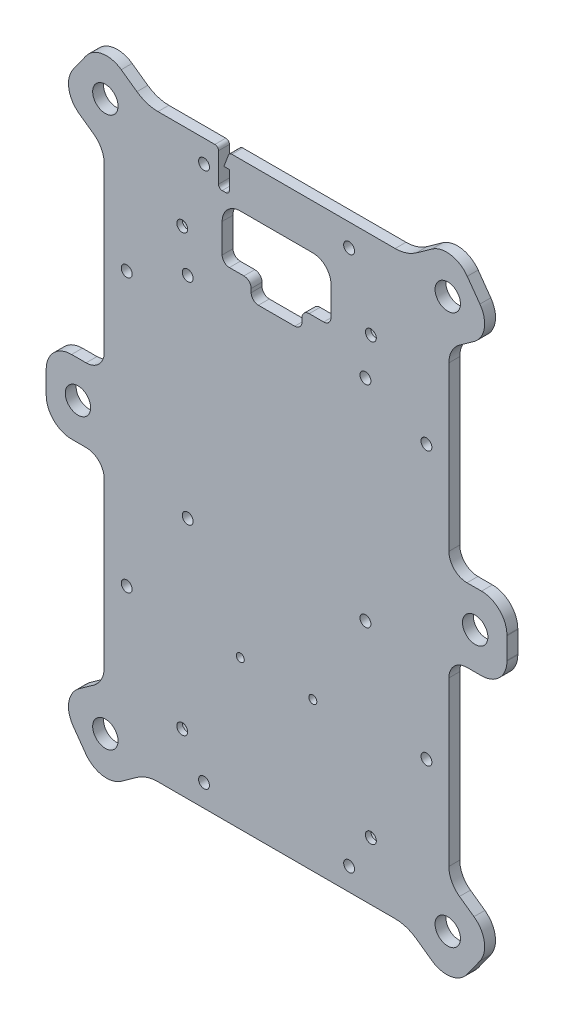
from build123d import *

# Parameters (mm, degrees)
SKETCH1_R           = 3.5
SKETCH1_R_2         = 1.5
SKETCH1_R_3         = 1.1
EXTRUDE_1_DEPTH     = 3
CUT_EXTRUDE_1_DEPTH = 1.5


with BuildPart() as part:
    # Sketch1 → Бобышка-Вытянуть1 (new body)
    with BuildSketch(Plane.XY):
        with BuildLine():
            Line((-24.498196466, 18.686253871), (-28.812938034, 21.763271713))
            ThreePointArc((-28.812938034, 21.763271713), (-34.033313652, 22.967935089), (-38.576502294, 20.128397731))
            Line((-38.576502294, 20.128397731), (-42.0602267, 15.24335277))
            ThreePointArc((-42.0602267, 15.24335277), (-43.264890076, 10.022977152), (-40.425352718, 5.47978851))
            Line((-40.425352718, 5.47978851), (-36.440527218, 2.638047245))
            ThreePointArc((-36.440527218, 2.638047245), (-34.281914219, 0.144259766), (-33.504872357, -3.061171876))
            Line((-33.504872357, -3.061171876), (-33.504872357, -48.061171876))
            ThreePointArc((-33.504872357, -48.061171876), (-34.969338451, -51.596705782), (-38.504872357, -53.061171876))
            Line((-38.504872357, -53.061171876), (-42.504872357, -53.061171876))
            ThreePointArc((-42.504872357, -53.061171876), (-47.454619825, -55.111424407), (-49.504872357, -60.061171876))
            Line((-49.504872357, -60.061171876), (-49.500334917, -60.235639257))
            Line((-49.500334917, -60.235639257), (-49.500334917, -66.108369799))
            Line((-49.500334917, -66.108369799), (-49.504872357, -66.28283718))
            ThreePointArc((-49.504872357, -66.28283718), (-47.454619825, -71.232584649), (-42.504872357, -73.28283718))
            Line((-42.504872357, -73.28283718), (-38.504872357, -73.28283718))
            ThreePointArc((-38.504872357, -73.28283718), (-34.969338451, -74.747303275), (-33.504872357, -78.28283718))
            Line((-33.504872357, -78.28283718), (-33.504872357, -123.28283718))
            ThreePointArc((-33.504872357, -123.28283718), (-34.281914219, -126.488268823), (-36.440527218, -128.982056301))
            Line((-36.440527218, -128.982056301), (-40.425352718, -131.823797566))
            ThreePointArc((-40.425352718, -131.823797566), (-43.264890076, -136.366986209), (-42.0602267, -141.587361827))
            Line((-42.0602267, -141.587361827), (-38.576502294, -146.472406787))
            ThreePointArc((-38.576502294, -146.472406787), (-34.033313652, -149.311944145), (-28.812938034, -148.107280769))
            Line((-28.812938034, -148.107280769), (-24.498196466, -145.030262927))
            ThreePointArc((-24.498196466, -145.030262927), (-21.740151192, -143.647892601), (-18.691989124, -143.172004528))
            Line((-18.691989124, -143.172004528), (46.687073776, -143.172004528))
            ThreePointArc((46.687073776, -143.172004528), (49.735235844, -143.647892601), (52.493281118, -145.030262927))
            Line((52.493281118, -145.030262927), (56.808022686, -148.107280769))
            ThreePointArc((56.808022686, -148.107280769), (62.028398304, -149.311944145), (66.571586947, -146.472406787))
            Line((66.571586947, -146.472406787), (70.055311352, -141.587361827))
            ThreePointArc((70.055311352, -141.587361827), (71.259974728, -136.366986209), (68.42043737, -131.823797566))
            Line((68.42043737, -131.823797566), (64.43561187, -128.982056301))
            ThreePointArc((64.43561187, -128.982056301), (62.276998871, -126.488268823), (61.499957009, -123.28283718))
            Line((61.499957009, -123.28283718), (61.499957009, -78.28283718))
            ThreePointArc((61.499957009, -78.28283718), (62.964423103, -74.747303275), (66.499957009, -73.28283718))
            Line((66.499957009, -73.28283718), (70.499957009, -73.28283718))
            ThreePointArc((70.499957009, -73.28283718), (75.449704478, -71.232584649), (77.499957009, -66.28283718))
            Line((77.499957009, -66.28283718), (77.495419569, -66.108369799))
            Line((77.495419569, -66.108369799), (77.495419569, -60.235639257))
            Line((77.495419569, -60.235639257), (77.499957009, -60.061171876))
            ThreePointArc((77.499957009, -60.061171876), (75.449704478, -55.111424407), (70.499957009, -53.061171876))
            Line((70.499957009, -53.061171876), (66.499957009, -53.061171876))
            ThreePointArc((66.499957009, -53.061171876), (62.964423103, -51.596705782), (61.499957009, -48.061171876))
            Line((61.499957009, -48.061171876), (61.499957009, -3.061171876))
            ThreePointArc((61.499957009, -3.061171876), (62.276998871, 0.144259766), (64.43561187, 2.638047245))
            Line((64.43561187, 2.638047245), (68.42043737, 5.47978851))
            ThreePointArc((68.42043737, 5.47978851), (71.259974728, 10.022977152), (70.055311352, 15.24335277))
            Line((70.055311352, 15.24335277), (66.571586947, 20.128397731))
            ThreePointArc((66.571586947, 20.128397731), (62.028398304, 22.967935089), (56.808022686, 21.763271713))
            Line((56.808022686, 21.763271713), (52.493281118, 18.686253871))
            ThreePointArc((52.493281118, 18.686253871), (49.735235844, 17.303883544), (46.687073776, 16.827995472))
            Line((46.687073776, 16.827995472), (1.690542794, 16.827995472))
            ThreePointArc((1.690542794, 16.827995472), (1.120947956, 16.649921089), (0.754213617, 16.179118913))
            Line((0.754213617, 16.179118913), (-0.502457674, 12.827995472))
            Line((-0.502457674, 12.827995472), (0.997542326, 12.827995472))
            Line((0.997542326, 12.827995472), (0.997542326, 7.827995472))
            ThreePointArc((0.997542326, 7.827995472), (0.704649107, 7.120888691), (-0.002457674, 6.827995472))
            Line((-0.002457674, 6.827995472), (-1.002457674, 6.827995472))
            ThreePointArc((-1.002457674, 6.827995472), (-1.709564455, 7.120888691), (-2.002457674, 7.827995472))
            Line((-2.002457674, 7.827995472), (-2.002457674, 15.827995472))
            ThreePointArc((-2.002457674, 15.827995472), (-2.295350893, 16.535102253), (-3.002457674, 16.827995472))
            Line((-3.002457674, 16.827995472), (-18.691989124, 16.827995472))
            ThreePointArc((-18.691989124, 16.827995472), (-21.740151192, 17.303883544), (-24.498196466, 18.686253871))
        make_face()
        with Locations((68.745419569, -63.172004528)):
            Circle(SKETCH1_R, mode=Mode.SUBTRACT)
        with Locations((-40.750334917, -63.172004528)):
            Circle(SKETCH1_R, mode=Mode.SUBTRACT)
        with Locations((33.997542326, 10.633411798)):
            Circle(SKETCH1_R_2, mode=Mode.SUBTRACT)
        with Locations((-6.002457674, 10.633411798)):
            Circle(SKETCH1_R_2, mode=Mode.SUBTRACT)
        with Locations((-33.194340596, 12.605443826)):
            Circle(SKETCH1_R, mode=Mode.SUBTRACT)
        with Locations(Location((61.189425248, 12.605443826, 0), (0, 0, 180))):
            Circle(SKETCH1_R, mode=Mode.SUBTRACT)
        with Locations(Location((-6.002457674, -136.977420854, 0), (0, 0, 180))):
            Circle(SKETCH1_R_2, mode=Mode.SUBTRACT)
        with Locations(Location((33.997542326, -136.977420854, 0), (0, 0, 180))):
            Circle(SKETCH1_R_2, mode=Mode.SUBTRACT)
        with Locations((-27.314872357, -100.78283718)):
            Circle(SKETCH1_R_2, mode=Mode.SUBTRACT)
        with Locations((55.309957009, -100.78283718)):
            Circle(SKETCH1_R_2, mode=Mode.SUBTRACT)
        with Locations((-27.314872357, -25.561171876)):
            Circle(SKETCH1_R_2, mode=Mode.SUBTRACT)
        with Locations((55.309957009, -25.561171876)):
            Circle(SKETCH1_R_2, mode=Mode.SUBTRACT)
        with Locations((-12.002457674, -127.18381063)):
            Circle(SKETCH1_R_2, mode=Mode.SUBTRACT)
        with Locations((39.997542326, -127.18381063)):
            Circle(SKETCH1_R_2, mode=Mode.SUBTRACT)
        with Locations((61.189425248, -138.949452883)):
            Circle(SKETCH1_R, mode=Mode.SUBTRACT)
        with Locations(Location((-33.194340596, -138.949452883, 0), (0, 0, 180))):
            Circle(SKETCH1_R, mode=Mode.SUBTRACT)
        with Locations((38.497542326, -76.172004528)):
            Circle(SKETCH1_R_2, mode=Mode.SUBTRACT)
        with Locations((-10.502457674, -76.172004528)):
            Circle(SKETCH1_R_2, mode=Mode.SUBTRACT)
        with Locations((39.997542326, -7.18381063)):
            Circle(SKETCH1_R_2, mode=Mode.SUBTRACT)
        with Locations((-12.002457674, -7.18381063)):
            Circle(SKETCH1_R_2, mode=Mode.SUBTRACT)
        with Locations((3.997542326, -102.172004528)):
            Circle(SKETCH1_R_3, mode=Mode.SUBTRACT)
        with Locations((23.997542326, -102.172004528)):
            Circle(SKETCH1_R_3, mode=Mode.SUBTRACT)
        with Locations((38.497542326, -18.172004528)):
            Circle(SKETCH1_R_2, mode=Mode.SUBTRACT)
        with Locations((-10.502457674, -18.172004528)):
            Circle(SKETCH1_R_2, mode=Mode.SUBTRACT)
        with BuildLine():
            Line((22.997542326, -10.561171876), (26.997542326, -10.561171876))
            ThreePointArc((26.997542326, -10.561171876), (28.411755888, -9.975385438), (28.997542326, -8.561171876))
            Line((28.997542326, -8.561171876), (28.997542326, -0.561171876))
            ThreePointArc((28.997542326, -0.561171876), (27.533076232, 2.97436203), (23.997542326, 4.438828124))
            Line((23.997542326, 4.438828124), (3.997542326, 4.438828124))
            ThreePointArc((3.997542326, 4.438828124), (0.46200842, 2.97436203), (-1.002457674, -0.561171876))
            Line((-1.002457674, -0.561171876), (-1.002457674, -8.561171876))
            ThreePointArc((-1.002457674, -8.561171876), (-0.416671236, -9.975385438), (0.997542326, -10.561171876))
            Line((0.997542326, -10.561171876), (4.997542326, -10.561171876))
            ThreePointArc((4.997542326, -10.561171876), (6.411755888, -11.146958313), (6.997542326, -12.561171876))
            Line((6.997542326, -12.561171876), (6.997542326, -13.561171876))
            ThreePointArc((6.997542326, -13.561171876), (7.583328764, -14.975385438), (8.997542326, -15.561171876))
            Line((8.997542326, -15.561171876), (18.997542326, -15.561171876))
            ThreePointArc((18.997542326, -15.561171876), (20.411755888, -14.975385438), (20.997542326, -13.561171876))
            Line((20.997542326, -13.561171876), (20.997542326, -12.561171876))
            ThreePointArc((20.997542326, -12.561171876), (21.583328764, -11.146958313), (22.997542326, -10.561171876))
        make_face(mode=Mode.SUBTRACT)
    extrude(amount=-EXTRUDE_1_DEPTH)

    # Эскиз1 → Вырез-Вытянуть1 (cut)
    with BuildSketch(Plane(origin=(0, 0, -3), x_dir=(-1, 0, 0), z_dir=(0, 0, -1))):
        Polygon((12.002457674, -4.08381063), (9.317778922, -5.63381063), (9.317778922, -8.73381063), (12.002457674, -10.28381063), (14.687136426, -8.73381063), (14.687136426, -5.63381063), align=None)
        Polygon((-39.997542326, -4.08381063), (-42.682221078, -5.63381063), (-42.682221078, -8.73381063), (-39.997542326, -10.28381063), (-37.312863574, -8.73381063), (-37.312863574, -5.63381063), align=None)
        Polygon((-39.997542326, -130.28381063), (-37.312863574, -128.73381063), (-37.312863574, -125.63381063), (-39.997542326, -124.08381063), (-42.682221078, -125.63381063), (-42.682221078, -128.73381063), align=None)
        Polygon((12.002457674, -130.28381063), (14.687136426, -128.73381063), (14.687136426, -125.63381063), (12.002457674, -124.08381063), (9.317778922, -125.63381063), (9.317778922, -128.73381063), align=None)
    extrude(amount=-CUT_EXTRUDE_1_DEPTH, mode=Mode.SUBTRACT)


solid = part.part
